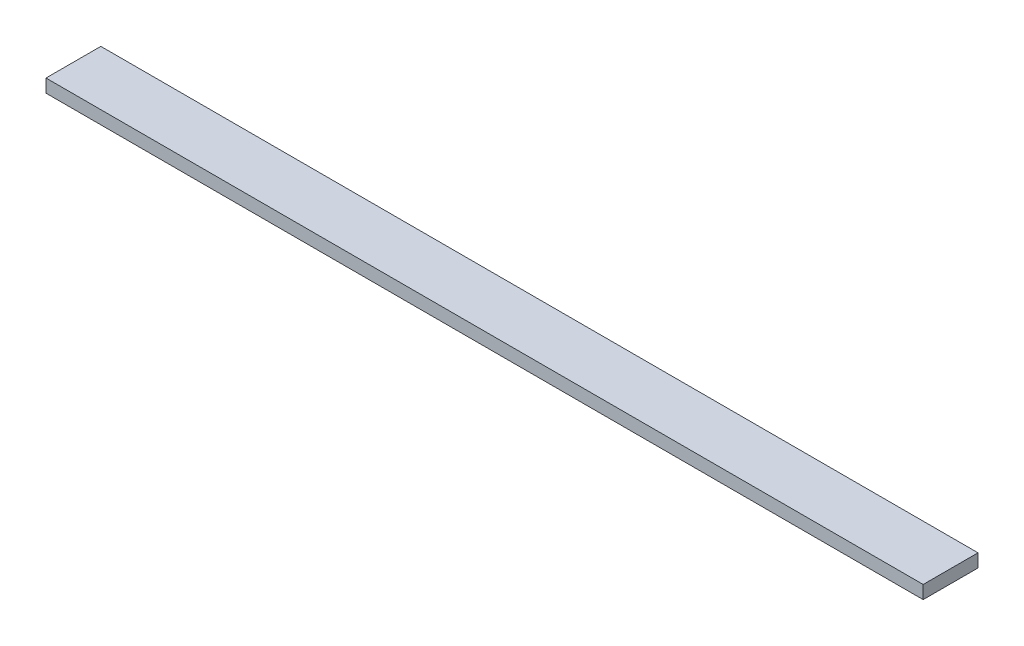
from build123d import *

# Parameters (mm, degrees)
SKETCH1_W           = 75
SKETCH1_H           = 18
BOSS_EXTRUDE1_DEPTH = 1200


with BuildPart() as part:
    # Sketch1 → Boss-Extrude1 (new body)
    with BuildSketch(Plane(origin=(0, 0, 0), x_dir=(0, 0, -1), z_dir=(1, 0, 0))):
        with Locations((-37.5, 9)):
            Rectangle(SKETCH1_W, SKETCH1_H)
    extrude(amount=BOSS_EXTRUDE1_DEPTH)


solid = part.part
